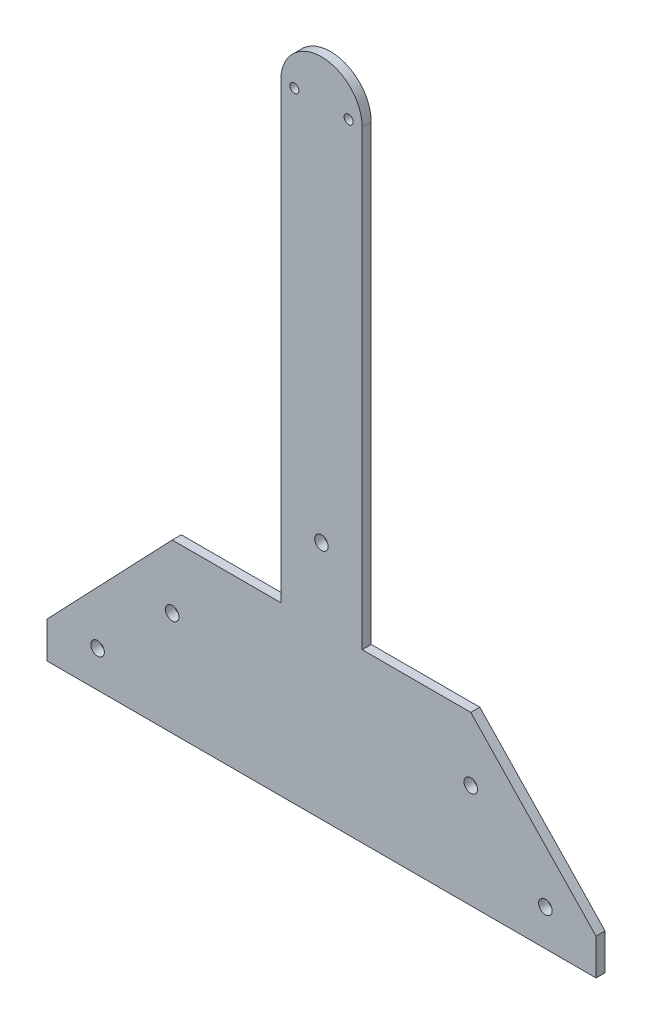
from build123d import *

# Parameters (mm, degrees)
SKETCH_1_R      = 1.5
SKETCH_1_R_2    = 1
EXTRUDE_1_DEPTH = 2


with BuildPart() as part:
    # 草图1 → 凸台-拉伸1 (new body)
    with BuildSketch(Plane.XY):
        with BuildLine():
            ThreePointArc((8.708571429, 121.645714286), (-0.291428571, 130.645714286), (-9.291428571, 121.645714286))
            Line((-9.291428571, 121.645714286), (-9.291428571, 21.645714286))
            Line((-9.291428571, 21.645714286), (-33.291428571, 21.645714286))
            Line((-33.291428571, 21.645714286), (-60.986481548, -7.354285714))
            Line((-60.986481548, -7.354285714), (-60.986481548, -15.354285714))
            Line((-60.986481548, -15.354285714), (60.403624405, -15.354285714))
            Line((60.403624405, -15.354285714), (60.403624405, -7.354285714))
            Line((60.403624405, -7.354285714), (32.708571429, 21.645714286))
            Line((32.708571429, 21.645714286), (8.708571429, 21.645714286))
            Line((8.708571429, 21.645714286), (8.708571429, 121.645714286))
        make_face()
        with Locations((-49.791428571, -7.354285714)):
            Circle(SKETCH_1_R, mode=Mode.SUBTRACT)
        with Locations((-33.291428571, 7.645714286)):
            Circle(SKETCH_1_R, mode=Mode.SUBTRACT)
        with Locations((-0.291428571, 37.645714286)):
            Circle(SKETCH_1_R, mode=Mode.SUBTRACT)
        with Locations((49.208571429, -7.354285714)):
            Circle(SKETCH_1_R, mode=Mode.SUBTRACT)
        with Locations((32.708571429, 7.645714286)):
            Circle(SKETCH_1_R, mode=Mode.SUBTRACT)
        with Locations((-6.291428571, 121.645714286)):
            Circle(SKETCH_1_R_2, mode=Mode.SUBTRACT)
        with Locations((5.708571429, 121.645714286)):
            Circle(SKETCH_1_R_2, mode=Mode.SUBTRACT)
    extrude(amount=EXTRUDE_1_DEPTH)


solid = part.part
